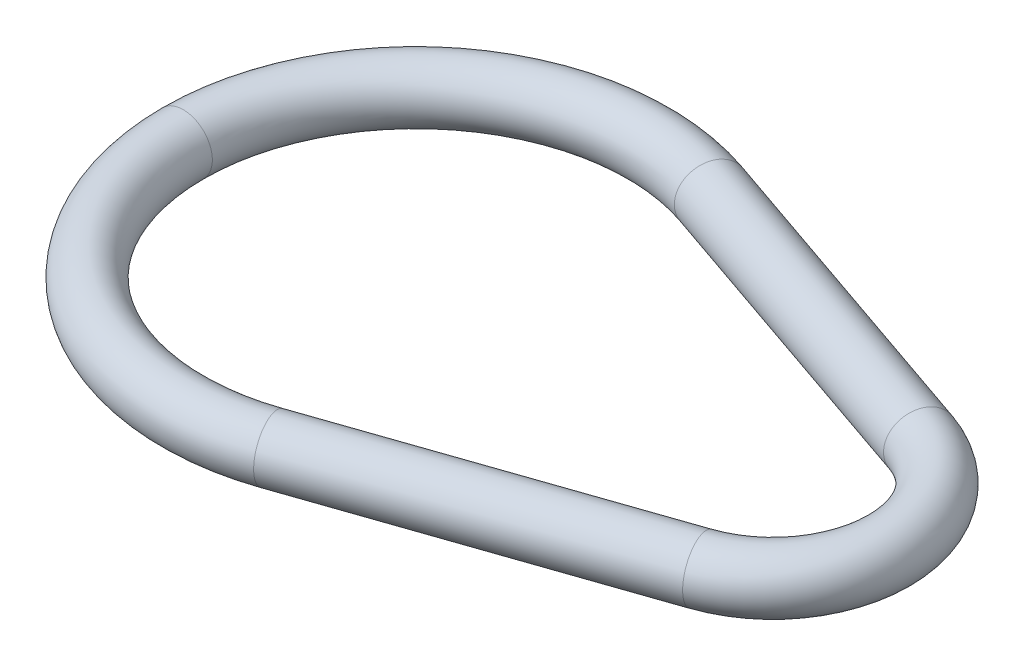
from build123d import *

# Parameters (mm, degrees)
SKETCH2_R = 3.175


with BuildPart() as part:
    # Sweep1: sweep along a path in Sketch1
    with BuildLine(Plane(origin=(0, 0, 0), x_dir=(1, 0, 0), z_dir=(0, 1, 0))) as sweep1_path:
        Line((8.271282051, 24.015534415), (43.135641026, 12.007767207))
        ThreePointArc((43.135641026, 12.007767207), (51.7, 0), (43.135641026, -12.007767207))
        Line((43.135641026, -12.007767207), (8.271282051, -24.015534415))
        ThreePointArc((8.271282051, -24.015534415), (-25.4, 0), (8.271282051, 24.015534415))
    # Sketch2 → Sweep1 (sweep)
    with BuildSketch(Plane.XY):
        with Locations((-25.4, 0)):
            Circle(SKETCH2_R)
    sweep(path=sweep1_path.line)


solid = part.part
